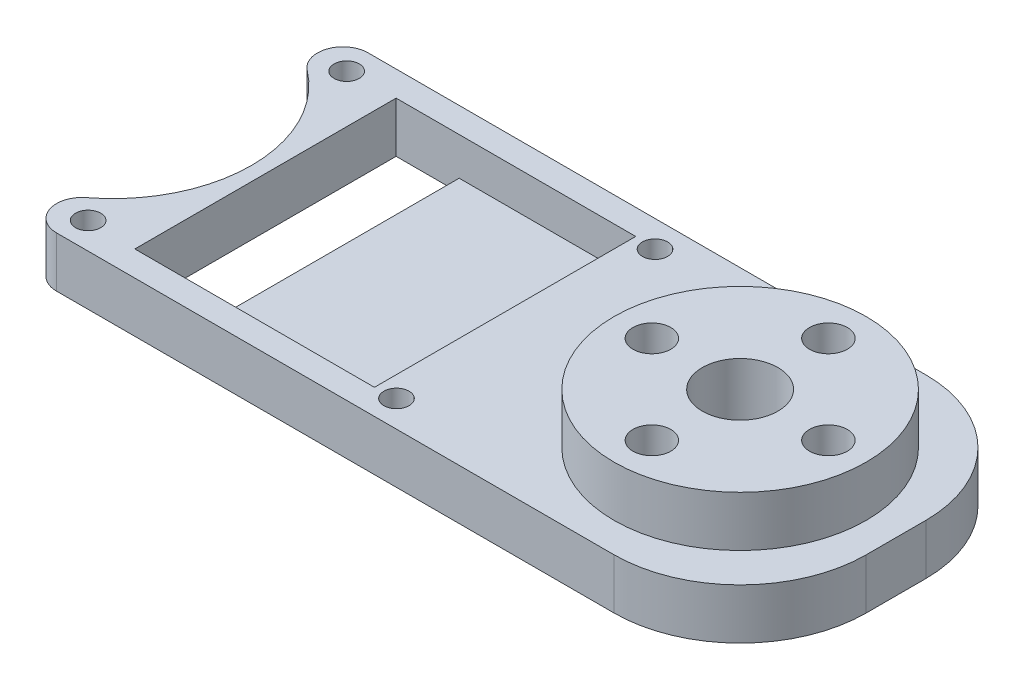
from build123d import *

# Parameters (mm, degrees)
EXTRUDE_1_DEPTH          = 4
CUT_EXTRUDE_1_DEPTH      = 38.905694823
CUT_EXTRUDE_1_DEPTH_BACK = 38.905694823
SKETCH_2_R               = 1
SKETCH_3_W               = 14
SKETCH_3_H               = 20.72
CUT_EXTRUDE_3_DEPTH      = 3
SKETCH_5_W               = 5
SKETCH_5_H               = 20.72
CUT_EXTRUDE_4_DEPTH      = 4
SKETCH_13_W              = 24.72
SKETCH_13_H              = 4
EXTRUDE_5_DEPTH          = 27
SKETCH_15_R              = 10
EXTRUDE_6_DEPTH          = 4
SKETCH_14_R              = 1.5
CUT_EXTRUDE_7_DEPTH      = 4
FILLET_1_R               = 10
FILLET_2_R               = 10
SKETCH_6_R               = 11
CUT_EXTRUDE_9_DEPTH      = 4
SKETCH_17_W              = 24.72
SKETCH_17_H              = 4
CUT_EXTRUDE_10_DEPTH     = 16
FILLET_3_R               = 2
FILLET_4_R               = 2
FILLET_5_R               = 2
FILLET_6_R               = 2
SKETCH_18_R              = 3
CUT_EXTRUDE_11_DEPTH     = 13
SKETCH_20_R              = 3
CUT_EXTRUDE_12_DEPTH     = 3


with BuildPart() as part:
    # 草图1 → 凸台-拉伸1 (new body)
    with BuildSketch(Plane(origin=(0, 0, 0), x_dir=(1, 0, 0), z_dir=(0, 1, 0))):
        with BuildLine():
            Line((6.61, -12.36), (9.61, -12.36))
            Line((9.61, -12.36), (9.61, -9.36))
            Line((9.61, -9.36), (9.61, 9.36))
            Line((9.61, 9.36), (9.61, 12.36))
            Line((9.61, 12.36), (6.61, 12.36))
            Line((6.61, 12.36), (-32.61, 12.36))
            ThreePointArc((-32.61, 12.36), (-34.731320344, 11.481320344), (-35.61, 9.36))
            Line((-35.61, 9.36), (-35.61, -9.36))
            ThreePointArc((-35.61, -9.36), (-34.731320344, -11.481320344), (-32.61, -12.36))
            Line((-32.61, -12.36), (6.61, -12.36))
        make_face()
    extrude(amount=EXTRUDE_1_DEPTH)

    # 草图2 → 切除-拉伸1 (cut, two sides: drawn at the far end of the back side and taken through both)
    with BuildSketch(Plane(origin=(0, 0, 0), x_dir=(1, 0, 0), z_dir=(0, 1, 0)).offset(-CUT_EXTRUDE_1_DEPTH_BACK)):
        with Locations(Location((7.25, -10.25, 0), (0, 0, 270))):
            Circle(SKETCH_2_R)
        with Locations(Location((7.25, 10.25, 0), (0, 0, 270))):
            Circle(SKETCH_2_R)
        with Locations(Location((-17.2, -10.25, 0), (0, 0, 270))):
            Circle(SKETCH_2_R)
        with Locations(Location((-17.2, 10.25, 0), (0, 0, 270))):
            Circle(SKETCH_2_R)
    extrude(amount=CUT_EXTRUDE_1_DEPTH + CUT_EXTRUDE_1_DEPTH_BACK, mode=Mode.SUBTRACT)

    # 草图3 → 切除-拉伸3 (cut)
    with BuildSketch(Plane(origin=(0, 4, 0), x_dir=(1, 0, 0), z_dir=(0, 1, 0))):
        with Locations((-1.39, 0)):
            Rectangle(SKETCH_3_W, SKETCH_3_H)
    extrude(amount=-CUT_EXTRUDE_3_DEPTH, mode=Mode.SUBTRACT)

    # 草图5 → 切除-拉伸4 (cut)
    with BuildSketch(Plane(origin=(0, 4, 0), x_dir=(1, 0, 0), z_dir=(0, 1, 0))):
        with Locations((-10.89, 0)):
            Rectangle(SKETCH_5_W, SKETCH_5_H)
    extrude(amount=-CUT_EXTRUDE_4_DEPTH, mode=Mode.SUBTRACT)

    # 草图13 → 凸台-拉伸5 (add)
    with BuildSketch(Plane(origin=(9.61, 0, 0), x_dir=(0, 0, -1), z_dir=(1, 0, 0))):
        with Locations((0, 2)):
            Rectangle(SKETCH_13_W, SKETCH_13_H)
    extrude(amount=EXTRUDE_5_DEPTH)

    # 草图15 → 凸台-拉伸6 (add)
    with BuildSketch(Plane(origin=(0, 4, 0), x_dir=(1, 0, 0), z_dir=(0, 1, 0))):
        with Locations(Location((24.25, 0, 0), (0, 0, 270))):
            Circle(SKETCH_15_R)
    extrude(amount=EXTRUDE_6_DEPTH)

    # 草图14 → 切除-拉伸7 (cut, symmetric)
    with BuildSketch(Plane(origin=(0, 4, 0), x_dir=(1, 0, 0), z_dir=(0, 1, 0))):
        with Locations(Location((24.25, -7, 0), (0, 0, 270))):
            Circle(SKETCH_14_R)
        with Locations(Location((31.25, 0, 0), (0, 0, 270))):
            Circle(SKETCH_14_R)
        with Locations(Location((24.25, 7, 0), (0, 0, 270))):
            Circle(SKETCH_14_R)
        with Locations(Location((17.25, 0, 0), (0, 0, 270))):
            Circle(SKETCH_14_R)
    extrude(amount=CUT_EXTRUDE_7_DEPTH, both=True, mode=Mode.SUBTRACT)

    # 圆角1
    fillet_1_edges = [part.edges().sort_by_distance(p)[0] for p in [
        (36.61, 2, -12.36),
    ]]
    fillet(fillet_1_edges, radius=FILLET_1_R)

    # 圆角2
    fillet_2_edges = [part.edges().sort_by_distance(p)[0] for p in [
        (36.61, 2, 12.36),
    ]]
    fillet(fillet_2_edges, radius=FILLET_2_R)

    # 草图6 → 切除-拉伸9 (cut)
    with BuildSketch(Plane(origin=(0, 4, 0), x_dir=(1, 0, 0), z_dir=(0, 1, 0))):
        with Locations((-25.5, 0)):
            Circle(SKETCH_6_R)
    extrude(amount=-CUT_EXTRUDE_9_DEPTH, mode=Mode.SUBTRACT)

    # 草图17 → 切除-拉伸10 (cut)
    with BuildSketch(Plane.ZY.offset(35.61)):
        with Locations((0, 2)):
            Rectangle(SKETCH_17_W, SKETCH_17_H)
    extrude(amount=-CUT_EXTRUDE_10_DEPTH, mode=Mode.SUBTRACT)

    # 圆角3
    fillet_3_edges = [part.edges().sort_by_distance(p)[0] for p in [
        (-19.61, 2, 12.36),
    ]]
    fillet(fillet_3_edges, radius=FILLET_3_R)

    # 圆角4
    fillet_4_edges = [part.edges().sort_by_distance(p)[0] for p in [
        (-19.61, 2, -12.36),
    ]]
    fillet(fillet_4_edges, radius=FILLET_4_R)

    # 圆角5
    fillet_5_edges = [part.edges().sort_by_distance(p)[0] for p in [
        (-19.61, 2, -9.290204519),
    ]]
    fillet(fillet_5_edges, radius=FILLET_5_R)

    # 圆角6
    fillet_6_edges = [part.edges().sort_by_distance(p)[0] for p in [
        (-19.61, 2, 9.290204519),
    ]]
    fillet(fillet_6_edges, radius=FILLET_6_R)

    # 草图18 → 切除-拉伸11 (cut)
    with BuildSketch(Plane(origin=(0, 8, 0), x_dir=(1, 0, 0), z_dir=(0, 1, 0))):
        with Locations(Location((24.25, 0, 0), (0, 0, 270))):
            Circle(SKETCH_18_R)
    extrude(amount=-CUT_EXTRUDE_11_DEPTH, mode=Mode.SUBTRACT)

    # 草图20 → 切除-拉伸12 (cut)
    with BuildSketch(Plane.XZ):
        with Locations(Location((24.25, 7, 0), (0, 0, 270))):
            Circle(SKETCH_20_R)
        with Locations(Location((17.25, 0, 0), (0, 0, 270))):
            Circle(SKETCH_20_R)
        with Locations(Location((24.25, -7, 0), (0, 0, 270))):
            Circle(SKETCH_20_R)
        with Locations(Location((31.25, 0, 0), (0, 0, 270))):
            Circle(SKETCH_20_R)
    extrude(amount=-CUT_EXTRUDE_12_DEPTH, mode=Mode.SUBTRACT)


solid = part.part
